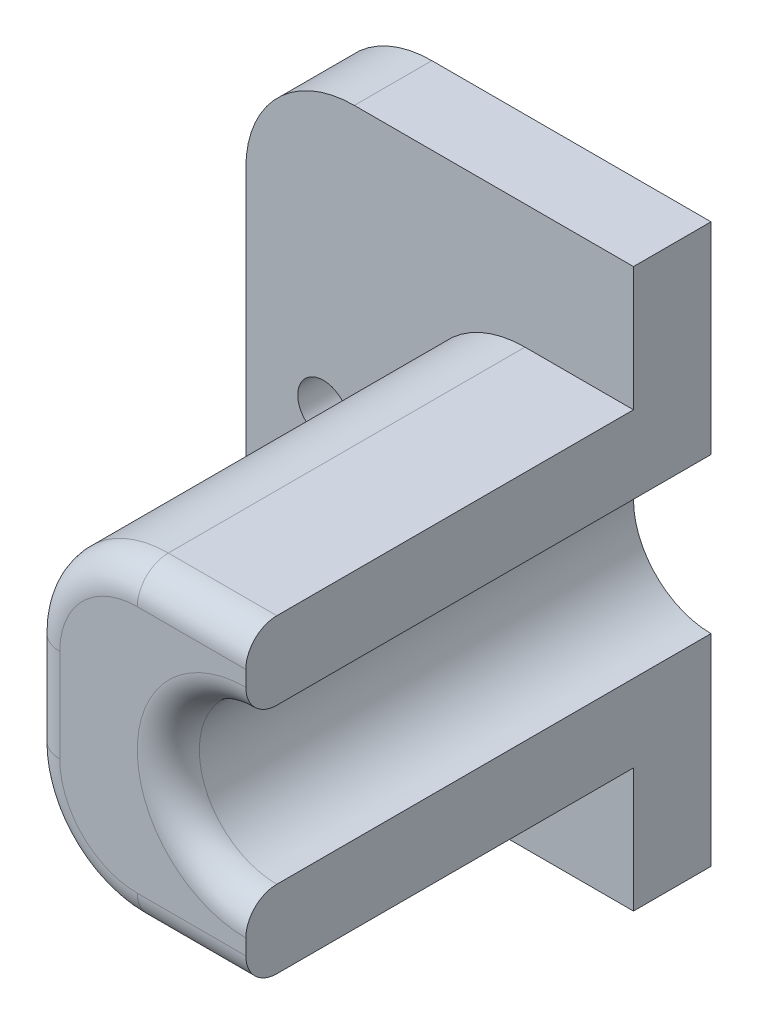
from build123d import *

# Parameters (mm, degrees)
SKETCH_1_W          = 25
SKETCH_1_H          = 36
SKETCH_1_R          = 1.65
EXTRUDE_1_DEPTH     = 5
SKETCH_2_W          = 14
SKETCH_2_H          = 20
EXTRUDE_2_DEPTH     = 25
SKETCH_3_R          = 5
CUT_EXTRUDE_1_DEPTH = 35
FILLET_1_R          = 7
FILLET_2_R          = 7
FILLET_3_R          = 7
FILLET_4_R          = 7
FILLET_5_R          = 2


with BuildPart() as part:
    # ｽｹｯﾁ1 → ﾎﾞｽ - 押し出し1 (new body)
    with BuildSketch(Plane.XY):
        with Locations((-12.5, 0)):
            Rectangle(SKETCH_1_W, SKETCH_1_H)
        with Locations((-20, 0)):
            Circle(SKETCH_1_R, mode=Mode.SUBTRACT)
    extrude(amount=EXTRUDE_1_DEPTH)

    # ｽｹｯﾁ2 → ﾎﾞｽ - 押し出し2 (add)
    with BuildSketch(Plane.XY.offset(5)):
        with Locations((-7, 0)):
            Rectangle(SKETCH_2_W, SKETCH_2_H)
    extrude(amount=EXTRUDE_2_DEPTH)

    # ｽｹｯﾁ3 → ｶｯﾄ - 押し出し1 (cut)
    with BuildSketch(Plane.XY.offset(30)):
        Circle(SKETCH_3_R)
    extrude(amount=-CUT_EXTRUDE_1_DEPTH, mode=Mode.SUBTRACT)

    # ﾌｨﾚｯﾄ1
    fillet_1_edges = [part.edges().sort_by_distance(p)[0] for p in [
        (-14, 10, 17.5),
    ]]
    fillet(fillet_1_edges, radius=FILLET_1_R)

    # ﾌｨﾚｯﾄ2
    fillet_2_edges = [part.edges().sort_by_distance(p)[0] for p in [
        (-14, -10, 17.5),
    ]]
    fillet(fillet_2_edges, radius=FILLET_2_R)

    # ﾌｨﾚｯﾄ3
    fillet_3_edges = [part.edges().sort_by_distance(p)[0] for p in [
        (-25, 18, 2.5),
    ]]
    fillet(fillet_3_edges, radius=FILLET_3_R)

    # ﾌｨﾚｯﾄ4
    fillet_4_edges = [part.edges().sort_by_distance(p)[0] for p in [
        (-25, -18, 2.5),
    ]]
    fillet(fillet_4_edges, radius=FILLET_4_R)

    # ﾌｨﾚｯﾄ5
    fillet_5_edges = [part.edges().sort_by_distance(p)[0] for p in [
        (-3.5, 10, 30),
        (-5, 0, 30),
        (-14, 0, 30),
        (-11.949747468, 7.949747468, 30),
        (-3.5, -10, 30),
        (-11.949747468, -7.949747468, 30),
    ]]
    fillet(fillet_5_edges, radius=FILLET_5_R)


solid = part.part
